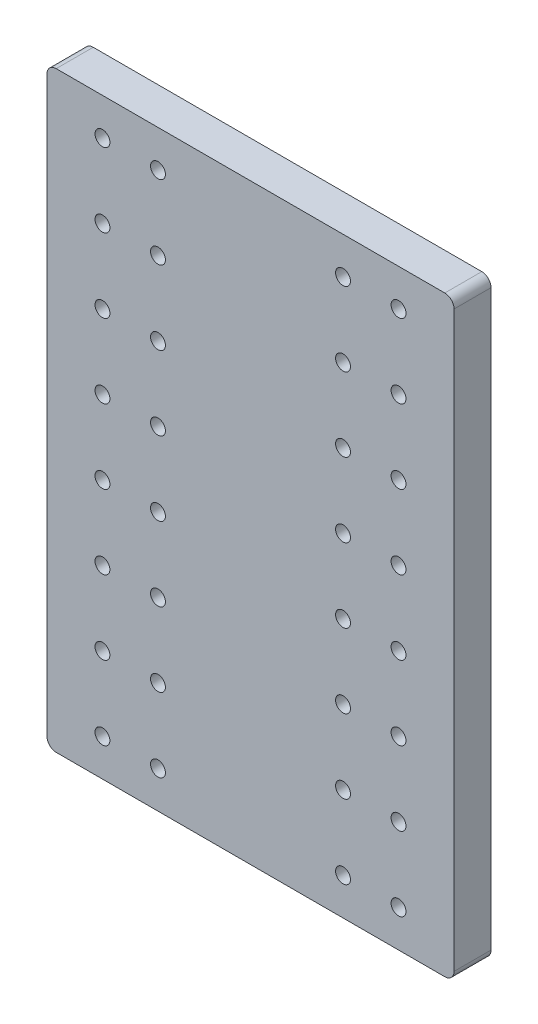
from build123d import *

# Parameters (mm, degrees)
MODEL_W             = 139.7
MODEL_H             = 203.2
MODEL_R             = 2.5527
BOSS_EXTRUDE1_DEPTH = 12.7
FILLET1_R           = 3.175


with BuildPart() as part:
    # Model → Boss-Extrude1 (new body)
    with BuildSketch(Plane.XY):
        with Locations((540.658235294, 473.817647059)):
            Rectangle(MODEL_W, MODEL_H)
        with Locations((591.458235294, 562.717647059)):
            Circle(MODEL_R, mode=Mode.SUBTRACT)
        with Locations((591.458235294, 486.517647059)):
            Circle(MODEL_R, mode=Mode.SUBTRACT)
        with Locations((489.858235294, 486.517647059)):
            Circle(MODEL_R, mode=Mode.SUBTRACT)
        with Locations((489.858235294, 562.717647059)):
            Circle(MODEL_R, mode=Mode.SUBTRACT)
        with Locations((591.458235294, 537.317647059)):
            Circle(MODEL_R, mode=Mode.SUBTRACT)
        with Locations((489.858235294, 537.317647059)):
            Circle(MODEL_R, mode=Mode.SUBTRACT)
        with Locations((591.458235294, 511.917647059)):
            Circle(MODEL_R, mode=Mode.SUBTRACT)
        with Locations((489.858235294, 511.917647059)):
            Circle(MODEL_R, mode=Mode.SUBTRACT)
        with Locations((508.908235294, 486.517647059)):
            Circle(MODEL_R, mode=Mode.SUBTRACT)
        with Locations((508.908235294, 562.717647059)):
            Circle(MODEL_R, mode=Mode.SUBTRACT)
        with Locations((508.908235294, 537.317647059)):
            Circle(MODEL_R, mode=Mode.SUBTRACT)
        with Locations((508.908235294, 511.917647059)):
            Circle(MODEL_R, mode=Mode.SUBTRACT)
        with Locations((572.408235294, 562.717647059)):
            Circle(MODEL_R, mode=Mode.SUBTRACT)
        with Locations((572.408235294, 486.517647059)):
            Circle(MODEL_R, mode=Mode.SUBTRACT)
        with Locations((572.408235294, 537.317647059)):
            Circle(MODEL_R, mode=Mode.SUBTRACT)
        with Locations((572.408235294, 511.917647059)):
            Circle(MODEL_R, mode=Mode.SUBTRACT)
        with Locations((591.458235294, 410.317647059)):
            Circle(MODEL_R, mode=Mode.SUBTRACT)
        with Locations((489.858235294, 410.317647059)):
            Circle(MODEL_R, mode=Mode.SUBTRACT)
        with Locations((591.458235294, 435.717647059)):
            Circle(MODEL_R, mode=Mode.SUBTRACT)
        with Locations((489.858235294, 435.717647059)):
            Circle(MODEL_R, mode=Mode.SUBTRACT)
        with Locations((508.908235294, 410.317647059)):
            Circle(MODEL_R, mode=Mode.SUBTRACT)
        with Locations((508.908235294, 435.717647059)):
            Circle(MODEL_R, mode=Mode.SUBTRACT)
        with Locations((572.408235294, 410.317647059)):
            Circle(MODEL_R, mode=Mode.SUBTRACT)
        with Locations((572.408235294, 435.717647059)):
            Circle(MODEL_R, mode=Mode.SUBTRACT)
        with Locations((591.458235294, 384.917647059)):
            Circle(MODEL_R, mode=Mode.SUBTRACT)
        with Locations((489.858235294, 384.917647059)):
            Circle(MODEL_R, mode=Mode.SUBTRACT)
        with Locations((508.908235294, 384.917647059)):
            Circle(MODEL_R, mode=Mode.SUBTRACT)
        with Locations((572.408235294, 384.917647059)):
            Circle(MODEL_R, mode=Mode.SUBTRACT)
        with Locations((591.458235294, 461.117647059)):
            Circle(MODEL_R, mode=Mode.SUBTRACT)
        with Locations((489.858235294, 461.117647059)):
            Circle(MODEL_R, mode=Mode.SUBTRACT)
        with Locations((508.908235294, 461.117647059)):
            Circle(MODEL_R, mode=Mode.SUBTRACT)
        with Locations((572.408235294, 461.117647059)):
            Circle(MODEL_R, mode=Mode.SUBTRACT)
    extrude(amount=BOSS_EXTRUDE1_DEPTH)

    # Fillet1
    fillet1_edges = [part.edges().sort_by_distance(p)[0] for p in [
        (610.508235294, 372.217647059, 6.35),
        (470.808235294, 372.217647059, 6.35),
        (470.808235294, 575.417647059, 6.35),
        (610.508235294, 575.417647059, 6.35),
    ]]
    fillet(fillet1_edges, radius=FILLET1_R)


solid = part.part
